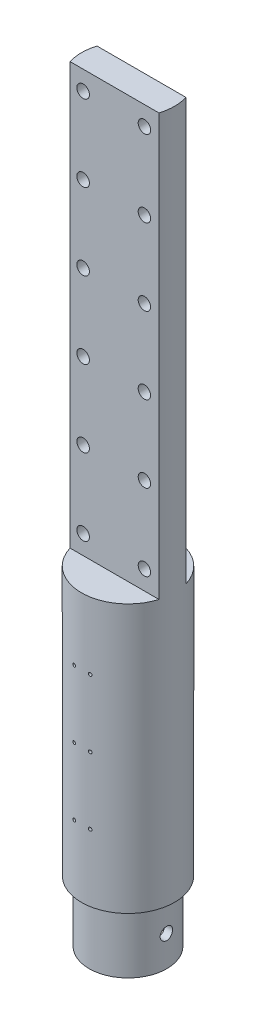
from build123d import *

# Parameters (mm, degrees)
SKETCH1_R               = 30.35
BOSS_EXTRUDE2_DEPTH     = 450
SKETCH1_3_R             = 25.35
SKETCH1_3_R_2           = 20.35
BOSS_EXTRUDE3_DEPTH     = 40
CUT_EXTRUDE3_START      = -275
CUT_EXTRUDE3_DEPTH      = 275
SKETCH8_R               = 1.05
CUT_EXTRUDE5_DEPTH      = 137
CUT_EXTRUDE6_DEPTH      = 137
CUT_EXTRUDE6_DEPTH_BACK = 137
SKETCH9_R               = 4.05
SKETCH10_R              = 4.05
SKETCH10_R_2            = 4.1
CUT_EXTRUDE7_DEPTH      = 137


with BuildPart() as part:
    # Sketch1 → Boss-Extrude2 (new body)
    with BuildSketch(Plane(origin=(0, 0, 0), x_dir=(1, 0, 0), z_dir=(0, 1, 0))):
        Circle(SKETCH1_R)
    extrude(amount=BOSS_EXTRUDE2_DEPTH)

    # Sketch1<3> → Boss-Extrude3 (add)
    with BuildSketch(Plane(origin=(0, 0, 0), x_dir=(1, 0, 0), z_dir=(0, 1, 0))):
        Circle(SKETCH1_3_R)
        Circle(SKETCH1_3_R_2, mode=Mode.SUBTRACT)
    extrude(amount=-BOSS_EXTRUDE3_DEPTH)

    # Sketch6 → Cut-Extrude3 (cut)
    with BuildSketch(Plane(origin=(0, 450, 0), x_dir=(1, 0, 0), z_dir=(0, 1, 0)).offset(CUT_EXTRUDE3_START)):
        with BuildLine():
            Line((29.046213178, -8.8), (-29.046213178, -8.8))
            ThreePointArc((-29.046213178, -8.8), (-28.149908871, -11.344828361), (-27.031139451, -13.8))
            Line((-27.031139451, -13.8), (-42.831763914, -13.8))
            ThreePointArc((-42.831763914, -13.8), (0, -45), (42.831763914, -13.8))
            Line((42.831763914, -13.8), (27.031139451, -13.8))
            ThreePointArc((27.031139451, -13.8), (28.149908871, -11.344828361), (29.046213178, -8.8))
        make_face()
        with BuildLine():
            Line((-29.046213178, 8.8), (29.046213178, 8.8))
            ThreePointArc((29.046213178, 8.8), (28.149908871, 11.344828361), (27.031139451, 13.8))
            Line((27.031139451, 13.8), (42.831763914, 13.8))
            ThreePointArc((42.831763914, 13.8), (0, 45), (-42.831763914, 13.8))
            Line((-42.831763914, 13.8), (-27.031139451, 13.8))
            ThreePointArc((-27.031139451, 13.8), (-28.149908871, 11.344828361), (-29.046213178, 8.8))
        make_face()
    extrude(amount=CUT_EXTRUDE3_DEPTH, mode=Mode.SUBTRACT)

    # Sketch8 → Cut-Extrude5 (cut)
    with BuildSketch(Plane.XY.offset(30.35)):
        with Locations((5.215, 131.25)):
            Circle(SKETCH8_R)
        with Locations((-5.215, 131.25)):
            Circle(SKETCH8_R)
        with Locations((-5.215, 87.5)):
            Circle(SKETCH8_R)
        with Locations((5.215, 87.5)):
            Circle(SKETCH8_R)
        with Locations((-5.215, 43.75)):
            Circle(SKETCH8_R)
        with Locations((5.215, 43.75)):
            Circle(SKETCH8_R)
    extrude(amount=-CUT_EXTRUDE5_DEPTH, mode=Mode.SUBTRACT)

    # Sketch9 → Cut-Extrude6 (cut, two sides: drawn at the far end of the back side and taken through both)
    with BuildSketch(Plane(origin=(0, 0, 0), x_dir=(0, 0, -1), z_dir=(1, 0, 0)).offset(-CUT_EXTRUDE6_DEPTH_BACK)):
        with Locations((0, -20)):
            Circle(SKETCH9_R)
    extrude(amount=CUT_EXTRUDE6_DEPTH + CUT_EXTRUDE6_DEPTH_BACK, mode=Mode.SUBTRACT)

    # Sketch10 → Cut-Extrude7 (cut)
    with BuildSketch(Plane(origin=(0, 0, -8.8), x_dir=(-1, 0, 0), z_dir=(0, 0, -1))):
        with Locations((-19.505808782, 237.535214406)):
            Circle(SKETCH10_R)
        with Locations((20.494191218, 237.535214406)):
            Circle(SKETCH10_R_2)
        with Locations((-19.505808782, 287.535214406)):
            Circle(SKETCH10_R)
        with Locations((20.494191218, 287.535214406)):
            Circle(SKETCH10_R_2)
        with Locations((-19.505808782, 337.535214406)):
            Circle(SKETCH10_R)
        with Locations((20.494191218, 337.535214406)):
            Circle(SKETCH10_R_2)
        with Locations((-19.505808782, 387.535214406)):
            Circle(SKETCH10_R)
        with Locations((20.494191218, 387.535214406)):
            Circle(SKETCH10_R_2)
        with Locations((-19.505808782, 187.535214406)):
            Circle(SKETCH10_R)
        with Locations((20.494191218, 187.535214406)):
            Circle(SKETCH10_R_2)
        with Locations((-19.505808782, 437.535214406)):
            Circle(SKETCH10_R)
        with Locations((20.494191218, 437.535214406)):
            Circle(SKETCH10_R_2)
    extrude(amount=-CUT_EXTRUDE7_DEPTH, mode=Mode.SUBTRACT)


solid = part.part
